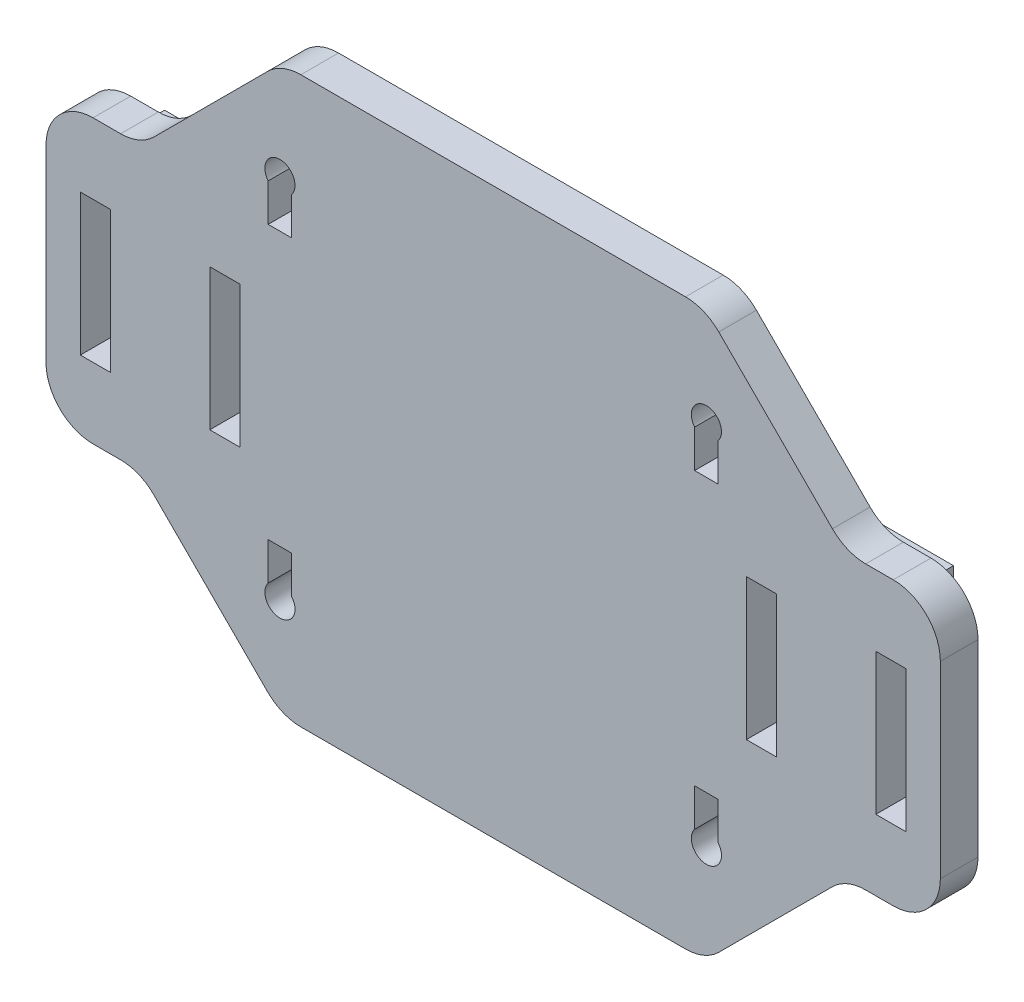
from build123d import *

# Parameters (mm, degrees)
SKETCH_1_W          = 75
SKETCH_1_H          = 60
EXTRUDE_1_DEPTH     = 4
SKETCH_2_W          = 3.2
SKETCH_2_H          = 15
CUT_EXTRUDE_1_DEPTH = 97.13012015
CUT_EXTRUDE_2_DEPTH = 97.13012015
CHAMFER_1_SIZE      = 15
SKETCH_7_W          = 10
SKETCH_7_H          = 30
EXTRUDE_3_DEPTH     = 4
SKETCH_8_W          = 3.2
SKETCH_8_H          = 15
CUT_EXTRUDE_5_DEPTH = 105.120122935
FILLET_1_R          = 5
EXTRUDE_2_DEPTH     = 3


with BuildPart() as part:
    # 草图1 → 凸台-拉伸1 (new body)
    with BuildSketch(Plane.XY):
        with Locations((37.5, 30)):
            Rectangle(SKETCH_1_W, SKETCH_1_H)
    extrude(amount=EXTRUDE_1_DEPTH)

    # 草图2 → 切除-拉伸1 (cut, through all)
    with BuildSketch(Plane.XY.offset(4)):
        with Locations((66, 30)):
            Rectangle(SKETCH_2_W, SKETCH_2_H)
        with Locations((9, 30)):
            Rectangle(SKETCH_2_W, SKETCH_2_H)
    extrude(amount=-CUT_EXTRUDE_1_DEPTH, mode=Mode.SUBTRACT)

    # 草图3 → 切除-拉伸2 (cut, through all)
    with BuildSketch(Plane.XY.offset(4)):
        with BuildLine():
            Line((58.9, 48.5), (58.9, 44.5))
            Line((58.9, 44.5), (61.4, 44.5))
            Line((61.4, 44.5), (61.4, 48.5))
            ThreePointArc((61.4, 48.5), (60.15, 51.098749218), (58.9, 48.5))
        make_face()
        with BuildLine():
            Line((58.9, 15.5), (61.4, 15.5))
            Line((61.4, 15.5), (61.4, 11.5))
            ThreePointArc((61.4, 11.5), (60.15, 8.901250782), (58.9, 11.5))
            Line((58.9, 11.5), (58.9, 15.5))
        make_face()
        with BuildLine():
            Line((16.1, 15.5), (16.1, 11.5))
            ThreePointArc((16.1, 11.5), (14.85, 8.901250782), (13.6, 11.5))
            Line((13.6, 11.5), (13.6, 15.5))
            Line((13.6, 15.5), (16.1, 15.5))
        make_face()
        with BuildLine():
            Line((13.6, 48.5), (13.6, 44.5))
            Line((13.6, 44.5), (16.1, 44.5))
            Line((16.1, 44.5), (16.1, 48.5))
            ThreePointArc((16.1, 48.5), (14.85, 51.098749218), (13.6, 48.5))
        make_face()
    extrude(amount=-CUT_EXTRUDE_2_DEPTH, mode=Mode.SUBTRACT)

    # 倒角1
    chamfer_1_edges = [part.edges().sort_by_distance(p)[0] for p in [
        (0, 60, 2),
        (75, 60, 2),
        (75, 0, 2),
        (0, 0, 2),
    ]]
    chamfer(chamfer_1_edges, length=CHAMFER_1_SIZE)

    # 草图7 → 凸台-拉伸3 (add)
    with BuildSketch(Plane.XY.offset(4)):
        with Locations((-5, 30)):
            Rectangle(SKETCH_7_W, SKETCH_7_H)
        with Locations((80, 30)):
            Rectangle(SKETCH_7_W, SKETCH_7_H)
    extrude(amount=-EXTRUDE_3_DEPTH)

    # 草图8 → 切除-拉伸5 (cut, through all)
    with BuildSketch(Plane.XY.offset(4)):
        with Locations((79.75, 30)):
            Rectangle(SKETCH_8_W, SKETCH_8_H)
        with Locations((-4.75, 30)):
            Rectangle(SKETCH_8_W, SKETCH_8_H)
    extrude(amount=-CUT_EXTRUDE_5_DEPTH, mode=Mode.SUBTRACT)

    # 圆角1
    fillet_1_edges = [part.edges().sort_by_distance(p)[0] for p in [
        (0, 15, 2),
        (0, 45, 2),
        (60, 60, 2),
        (15, 60, 2),
        (75, 45, 2),
        (75, 15, 2),
        (15, 0, 2),
        (60, 0, 2),
        (-10, 45, 2),
        (-10, 15, 2),
        (85, 15, 2),
        (85, 45, 2),
    ]]
    fillet(fillet_1_edges, radius=FILLET_1_R)

    # 草图5 → 凸台-拉伸2 (add)
    with BuildSketch(Plane(origin=(0, 0, 0), x_dir=(-1, 0, 0), z_dir=(0, 0, -1))):
        Polygon((-37.5, 42.5), (-79.4, 42.5), (-79.4, 38.5), (-39.5, 38.5), (-39.5, 21.5), (-79.4, 21.5), (-79.4, 17.5), (-37.5, 17.5), align=None)
        Polygon((4.4, 42.5), (-37.5, 42.5), (-37.5, 17.5), (4.4, 17.5), (4.4, 21.5), (-35.5, 21.5), (-35.5, 38.5), (4.4, 38.5), align=None)
    extrude(amount=EXTRUDE_2_DEPTH)


solid = part.part
